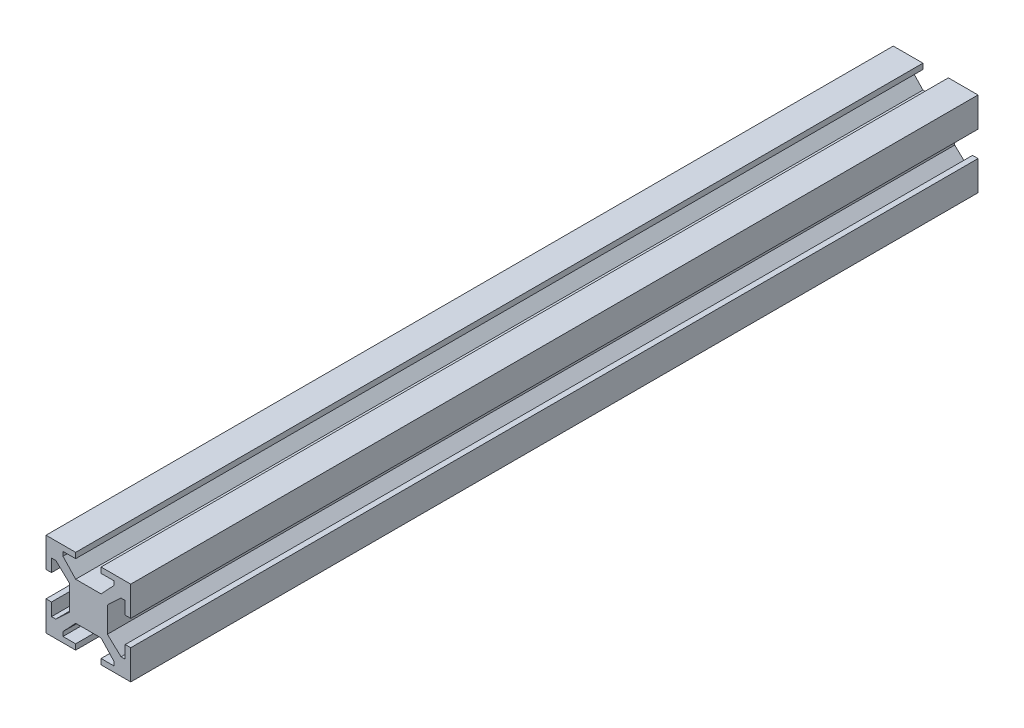
from build123d import *

# Parameters (mm, degrees)
BOSS_EXTRUDE1_DEPTH = 200


with BuildPart() as part:
    # Sketch1 → Boss-Extrude1 (new body)
    with BuildSketch(Plane.XY):
        Polygon((20, 0), (13, 0), (13, -1.3), (16, -1.3), (16, -2.3), (13, -5.5), (7, -5.5), (4, -2.3), (4, -1.3), (7, -1.3), (7, 0), (0, 0), (0, -7), (1.3, -7), (1.3, -4), (2.3, -4), (5.5, -7), (5.5, -13), (2.3, -16), (1.3, -16), (1.3, -13), (0, -13), (0, -20), (7, -20), (7, -18.7), (4, -18.7), (4, -17.7), (7, -14.5), (13, -14.5), (16, -17.7), (16, -18.7), (13, -18.7), (13, -20), (20, -20), (20, -13), (18.7, -13), (18.7, -16), (17.7, -16), (14.5, -13), (14.5, -7), (17.7, -4), (18.7, -4), (18.7, -7), (20, -7), align=None)
    extrude(amount=BOSS_EXTRUDE1_DEPTH)


solid = part.part
